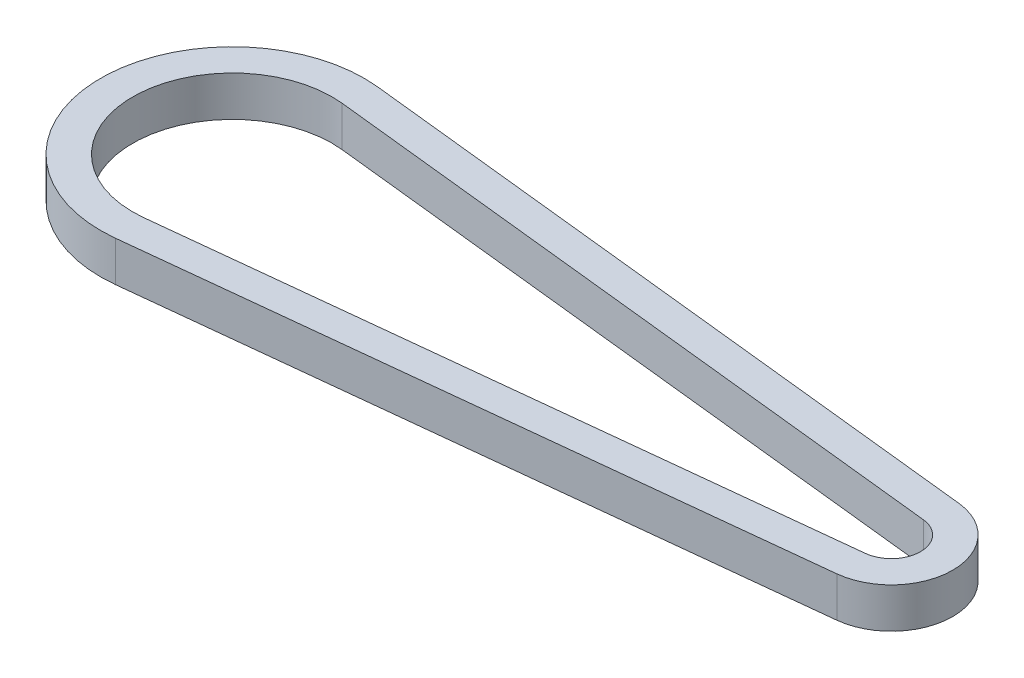
from build123d import *

# Parameters (mm, degrees)
EXTRUDE_THIN1_DEPTH = 12.5


with BuildPart() as part:
    # Sketch1 → Extrude-Thin1 (new body)
    with BuildSketch(Plane(origin=(0, 0, 0), x_dir=(1, 0, 0), z_dir=(0, 1, 0))):
        with BuildLine():
            Line((206.941310214, -18.981461022), (4.383956697, -40.764947242))
            ThreePointArc((4.383956697, -40.764947242), (-41, 0), (4.383956697, 40.764947242))
            Line((4.383956697, 40.764947242), (206.941310214, 18.981461022))
            ThreePointArc((206.941310214, 18.981461022), (223.990909091, 0), (206.941310214, -18.981461022))
        make_face()
        with BuildLine():
            Line((205.872052483, -9.038790963), (3.314698966, -30.822277183))
            ThreePointArc((3.314698966, -30.822277183), (-31, 0), (3.314698966, 30.822277183))
            Line((3.314698966, 30.822277183), (205.872052483, 9.038790963))
            ThreePointArc((205.872052483, 9.038790963), (213.990909091, 0), (205.872052483, -9.038790963))
        make_face(mode=Mode.SUBTRACT)
    extrude(amount=EXTRUDE_THIN1_DEPTH)


solid = part.part
